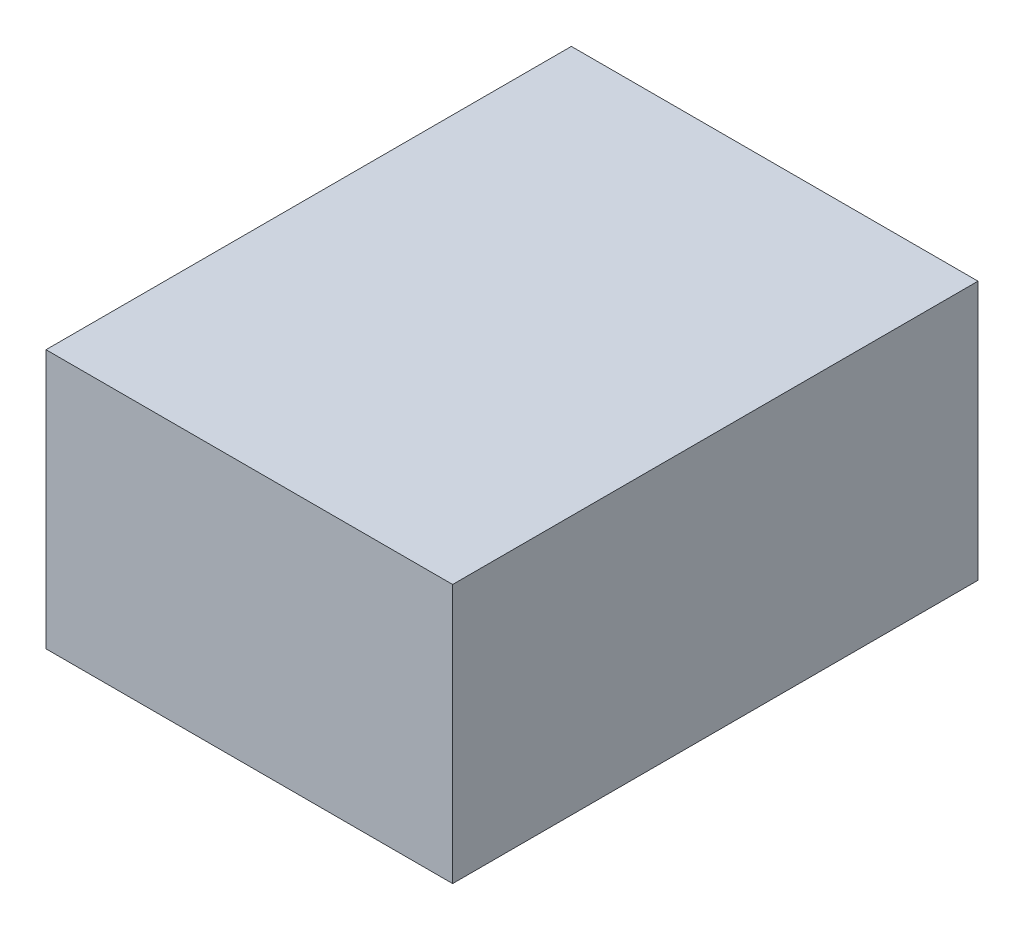
from build123d import *

# Parameters (mm, degrees)
SKETCH1_W           = 6200
SKETCH1_H           = 3950
BOSS_EXTRUDE1_DEPTH = 8000
SKETCH2_W           = 5000
SKETCH2_H           = 3500
CUT_EXTRUDE3_DEPTH  = 6200
SKETCH4_W           = 450
SKETCH4_H           = 3750
CUT_EXTRUDE5_DEPTH  = 6200
SKETCH5_W           = 5000
SKETCH5_H           = 200
CUT_EXTRUDE6_DEPTH  = 8000
SKETCH6_W           = 6000
SKETCH6_H           = 3757.085511021
CUT_EXTRUDE8_DEPTH  = 1600
SKETCH7_W           = 6200
SKETCH7_H           = 3950
BOSS_EXTRUDE2_DEPTH = 10


with BuildPart() as part:
    # Sketch1 → Boss-Extrude1 (new body)
    with BuildSketch(Plane.XY):
        Rectangle(SKETCH1_W, SKETCH1_H)
    extrude(amount=BOSS_EXTRUDE1_DEPTH)

    # Sketch2 → Cut-Extrude3 (cut)
    with BuildSketch(Plane.XY):
        with Locations((0, -125)):
            Rectangle(SKETCH2_W, SKETCH2_H)
    extrude(amount=CUT_EXTRUDE3_DEPTH, mode=Mode.SUBTRACT)

    # Sketch4 → Cut-Extrude5 (cut)
    with BuildSketch(Plane.XY):
        with Locations((2775, 0)):
            Rectangle(SKETCH4_W, SKETCH4_H)
        with Locations((-2775, -7.085511021)):
            Rectangle(SKETCH4_W, SKETCH4_H)
    extrude(amount=CUT_EXTRUDE5_DEPTH, mode=Mode.SUBTRACT)

    # Sketch5 → Cut-Extrude6 (cut)
    with BuildSketch(Plane(origin=(0, 0, 0), x_dir=(-1, 0, 0), z_dir=(0, 0, -1))):
        with Locations((0, 1775)):
            Rectangle(SKETCH5_W, SKETCH5_H)
    extrude(amount=-CUT_EXTRUDE6_DEPTH, mode=Mode.SUBTRACT)

    # Sketch6 → Cut-Extrude8 (cut)
    with BuildSketch(Plane.XY.offset(8000)):
        with Locations((0, -3.542755511)):
            Rectangle(SKETCH6_W, SKETCH6_H)
    extrude(amount=-CUT_EXTRUDE8_DEPTH, mode=Mode.SUBTRACT)

    # Sketch7 → Boss-Extrude2 (add)
    with BuildSketch(Plane.XY.offset(8000)):
        Rectangle(SKETCH7_W, SKETCH7_H)
    extrude(amount=BOSS_EXTRUDE2_DEPTH)


solid = part.part
